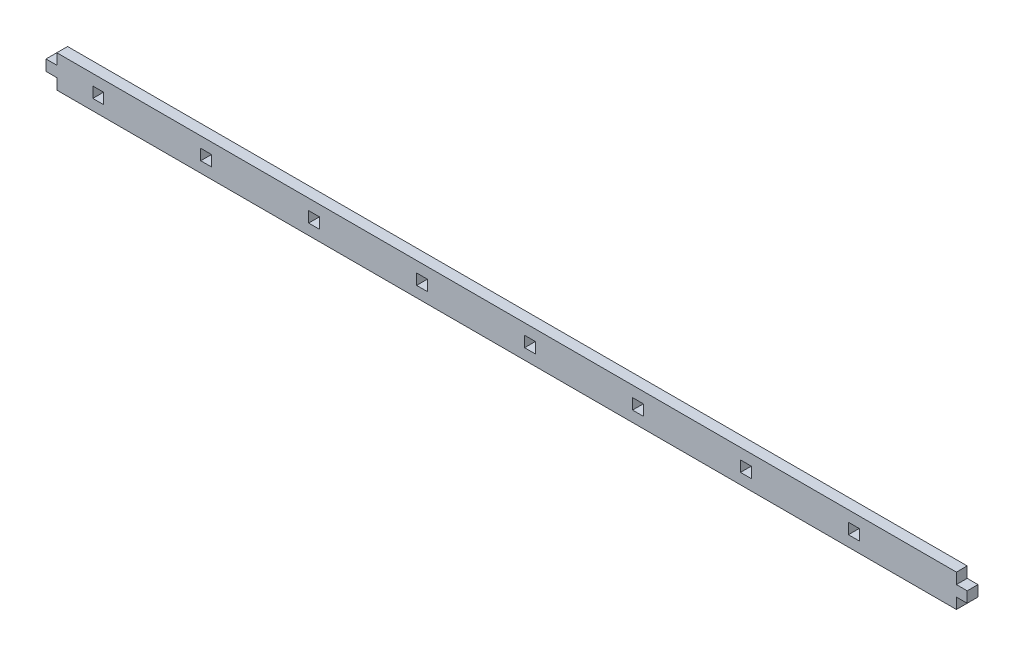
from build123d import *

# Parameters (mm, degrees)
SKETCH2_W           = 3
SKETCH2_H           = 3
BOSS_EXTRUDE3_DEPTH = 3


with BuildPart() as part:
    # Sketch2 → Boss-Extrude3 (new body)
    with BuildSketch(Plane.XY):
        Polygon((0, 0), (250, 0), (250, 3), (253, 3), (253, 6), (250, 6), (250, 9), (0, 9), (0, 6), (-3, 6), (-3, 3), (0, 3), align=None)
        with Locations((11.5, 4.5)):
            Rectangle(SKETCH2_W, SKETCH2_H, mode=Mode.SUBTRACT)
        with Locations((41.5, 4.5)):
            Rectangle(SKETCH2_W, SKETCH2_H, mode=Mode.SUBTRACT)
        with Locations((71.5, 4.5)):
            Rectangle(SKETCH2_W, SKETCH2_H, mode=Mode.SUBTRACT)
        with Locations((101.5, 4.5)):
            Rectangle(SKETCH2_W, SKETCH2_H, mode=Mode.SUBTRACT)
        with Locations((131.5, 4.5)):
            Rectangle(SKETCH2_W, SKETCH2_H, mode=Mode.SUBTRACT)
        with Locations((161.5, 4.5)):
            Rectangle(SKETCH2_W, SKETCH2_H, mode=Mode.SUBTRACT)
        with Locations((191.5, 4.5)):
            Rectangle(SKETCH2_W, SKETCH2_H, mode=Mode.SUBTRACT)
        with Locations((221.5, 4.5)):
            Rectangle(SKETCH2_W, SKETCH2_H, mode=Mode.SUBTRACT)
    extrude(amount=BOSS_EXTRUDE3_DEPTH)


solid = part.part
